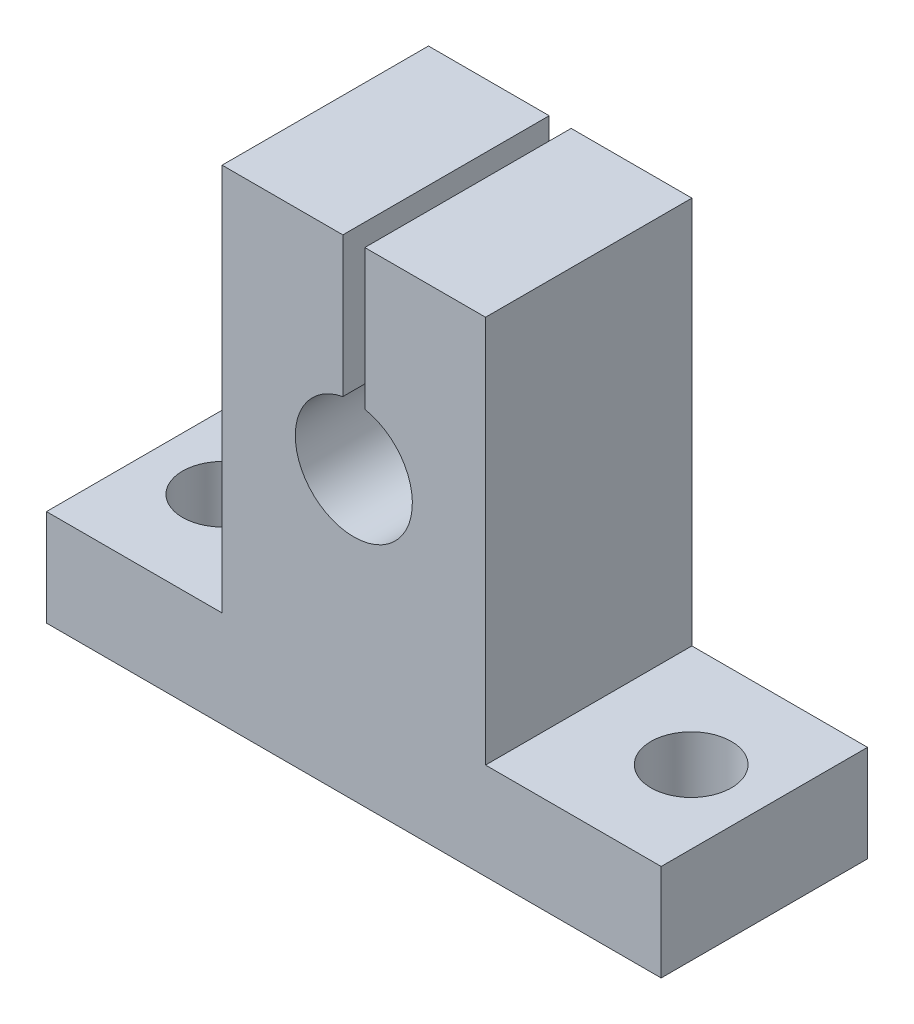
from build123d import *

# Parameters (mm, degrees)
BOSS_EXTRUDE1_DEPTH = 14.1
CUT_EXTRUDE1_DEPTH  = 14.1
SKETCH3_R           = 2.75
CUT_EXTRUDE2_DEPTH  = 56.302983645


with BuildPart() as part:
    # Sketch1 → Boss-Extrude1 (new body)
    with BuildSketch(Plane.XY):
        Polygon((0, 0), (42, 0), (42, 6.6), (30, 6.6), (30, 33.1), (12, 33.1), (12, 6.6), (0, 6.6), align=None)
    extrude(amount=-BOSS_EXTRUDE1_DEPTH)

    # Sketch2 → Cut-Extrude1 (cut)
    with BuildSketch(Plane.XY):
        with BuildLine():
            Line((20.25, 33.1), (21.75, 33.1))
            Line((21.75, 33.1), (21.75, 23.529058411))
            ThreePointArc((21.75, 23.529058411), (21, 15.6), (20.25, 23.529058411))
            Line((20.25, 23.529058411), (20.25, 33.1))
        make_face()
    extrude(amount=-CUT_EXTRUDE1_DEPTH, mode=Mode.SUBTRACT)

    # Sketch3 → Cut-Extrude2 (cut, through all)
    with BuildSketch(Plane.XZ):
        with Locations(Location((5, -7.05, 0), (0, 0, 270))):
            Circle(SKETCH3_R)
        with Locations(Location((37, -7.05, 0), (0, 0, 270))):
            Circle(SKETCH3_R)
    extrude(amount=-CUT_EXTRUDE2_DEPTH, mode=Mode.SUBTRACT)


solid = part.part
